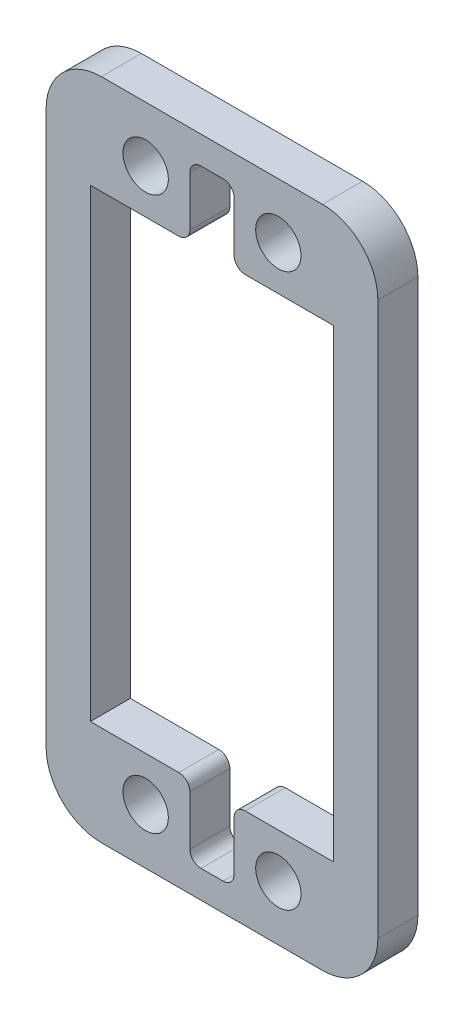
from build123d import *

# Parameters (mm, degrees)
CROQUIS1_W              = 30
CROQUIS1_H              = 60
SALIENTE_EXTRUIR1_DEPTH = 3.62
CROQUIS2_W              = 22
CROQUIS2_H              = 42
CORTAR_EXTRUIR1_DEPTH   = 34.73580294
CROQUIS3_R              = 2.05
CORTAR_EXTRUIR2_DEPTH   = 34.73580294
REDONDEO1_R             = 5
REDONDEO3_R             = 1


with BuildPart() as part:
    # Croquis1 → Saliente-Extruir1 (new body)
    with BuildSketch(Plane.XY):
        Rectangle(CROQUIS1_W, CROQUIS1_H)
    extrude(amount=SALIENTE_EXTRUIR1_DEPTH)

    # Croquis2 → Cortar-Extruir1 (cut, through all)
    with BuildSketch(Plane(origin=(0, 0, 0), x_dir=(-1, 0, 0), z_dir=(0, 0, -1))):
        Rectangle(CROQUIS2_W, CROQUIS2_H)
    extrude(amount=-CORTAR_EXTRUIR1_DEPTH, mode=Mode.SUBTRACT)

    # Croquis3 → Cortar-Extruir2 (cut, through all)
    with BuildSketch(Plane(origin=(0, 0, 0), x_dir=(-1, 0, 0), z_dir=(0, 0, -1))):
        with Locations((-6, 25)):
            Circle(CROQUIS3_R)
        with Locations((6, 25)):
            Circle(CROQUIS3_R)
        with Locations((-6, -25)):
            Circle(CROQUIS3_R)
        with Locations((6, -25)):
            Circle(CROQUIS3_R)
        Polygon((-2, 21), (-2, 27.5), (2, 27.5), (2, -27.5), (-2, -27.5), align=None)
    extrude(amount=-CORTAR_EXTRUIR2_DEPTH, mode=Mode.SUBTRACT)

    # Redondeo1
    redondeo1_edges = [part.edges().sort_by_distance(p)[0] for p in [
        (-15, 30, 1.81),
        (15, 30, 1.81),
        (15, -30, 1.81),
        (-15, -30, 1.81),
    ]]
    fillet(redondeo1_edges, radius=REDONDEO1_R)

    # Redondeo3
    redondeo3_edges = [part.edges().sort_by_distance(p)[0] for p in [
        (2, -21, 1.81),
        (-2, -21, 1.81),
        (-2, 21, 1.81),
        (-2, 27.5, 1.81),
        (2, 21, 1.81),
        (2, -27.5, 1.81),
        (-2, -27.5, 1.81),
        (2, 27.5, 1.81),
    ]]
    fillet(redondeo3_edges, radius=REDONDEO3_R)


solid = part.part
